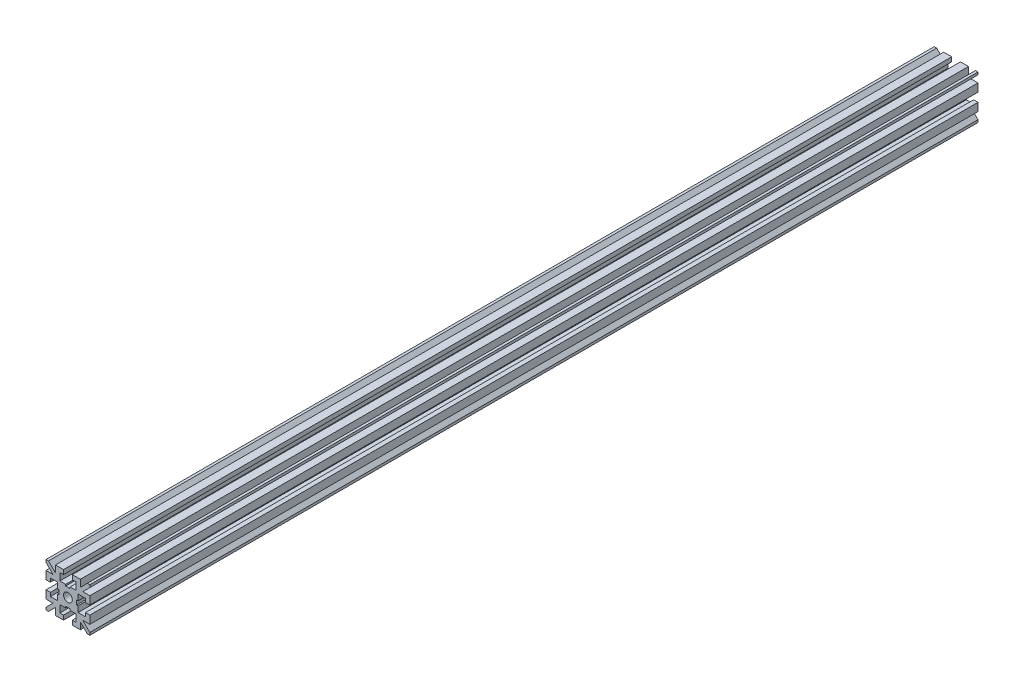
from build123d import *

# Parameters (mm, degrees)
SKETCH1_W           = 15
SKETCH1_H           = 15
BOSS_EXTRUDE1_DEPTH = 304.19
SKETCH2_R           = 1.5
CUT_EXTRUDE1_DEPTH  = 304.19
SKETCH3_W           = 3
SKETCH3_H           = 1.5
SKETCH3_W_2         = 1.5
SKETCH3_H_2         = 3
CUT_EXTRUDE2_DEPTH  = 304.19


with BuildPart() as part:
    # Sketch1 → Boss-Extrude1 (new body)
    with BuildSketch(Plane.XY):
        with Locations((-1.500578266, -3.738353388)):
            Rectangle(SKETCH1_W, SKETCH1_H)
    extrude(amount=BOSS_EXTRUDE1_DEPTH)

    # Sketch2 → Cut-Extrude1 (cut)
    with BuildSketch(Plane.XY.offset(304.19)):
        with Locations((-1.500578266, -3.738353388)):
            Circle(SKETCH2_R)
        Polygon((1.999421734, -4.488353388), (1.999421734, -6.488353388), (4.499421734, -6.488353388), (4.499421734, -0.988353388), (1.999421734, -0.988353388), (1.999421734, -2.988353388), (1.499421734, -2.988353388), (1.499421734, -4.488353388), align=None)
        Polygon((-4.250578266, -7.238353388), (-4.250578266, -9.738353388), (1.249421734, -9.738353388), (1.249421734, -7.238353388), (-0.750578266, -7.238353388), (-0.750578266, -6.738353388), (-2.250578266, -6.738353388), (-2.250578266, -7.238353388), align=None)
        Polygon((-5.000578266, -0.988353388), (-7.500578266, -0.988353388), (-7.500578266, -6.488353388), (-5.000578266, -6.488353388), (-5.000578266, -4.488353388), (-4.500578266, -4.488353388), (-4.500578266, -2.988353388), (-5.000578266, -2.988353388), align=None)
        Polygon((1.249421734, -0.238353388), (1.249421734, 2.261646612), (-4.250578266, 2.261646612), (-4.250578266, -0.238353388), (-2.250578266, -0.238353388), (-2.250578266, -0.738353388), (-0.750578266, -0.738353388), (-0.750578266, -0.238353388), align=None)
    extrude(amount=-CUT_EXTRUDE1_DEPTH, mode=Mode.SUBTRACT)

    # Sketch3 → Cut-Extrude2 (cut)
    with BuildSketch(Plane.XY.offset(304.19)):
        Polygon((5.150893596, 3.761646612), (2.749421734, 1.360174749), (2.749421734, 3.761646612), align=None)
        Polygon((5.999421734, 0.511646612), (5.999421734, 2.913118474), (3.597949871, 0.511646612), align=None)
        with Locations((-1.500578266, 3.011646612)):
            Rectangle(SKETCH3_W, SKETCH3_H)
        Polygon((2.749421734, -8.836881526), (2.749421734, -11.238353388), (5.150893596, -11.238353388), align=None)
        Polygon((5.999421734, -10.389825251), (3.597949871, -7.988353388), (5.999421734, -7.988353388), align=None)
        with Locations((5.249421734, -3.738353388)):
            Rectangle(SKETCH3_W_2, SKETCH3_H_2)
        Polygon((-6.599106404, -7.988353388), (-9.000578266, -7.988353388), (-9.000578266, -10.389825251), align=None)
        Polygon((-8.152050129, -11.238353388), (-5.750578266, -8.836881526), (-5.750578266, -11.238353388), align=None)
        with Locations((-1.500578266, -10.488353388)):
            Rectangle(SKETCH3_W, SKETCH3_H)
        Polygon((-5.750578266, 1.360174749), (-5.750578266, 3.761646612), (-8.152050129, 3.761646612), align=None)
        Polygon((-9.000578266, 2.913118474), (-6.599106404, 0.511646612), (-9.000578266, 0.511646612), align=None)
        with Locations((-8.250578266, -3.738353388)):
            Rectangle(SKETCH3_W_2, SKETCH3_H_2)
    extrude(amount=-CUT_EXTRUDE2_DEPTH, mode=Mode.SUBTRACT)


solid = part.part
